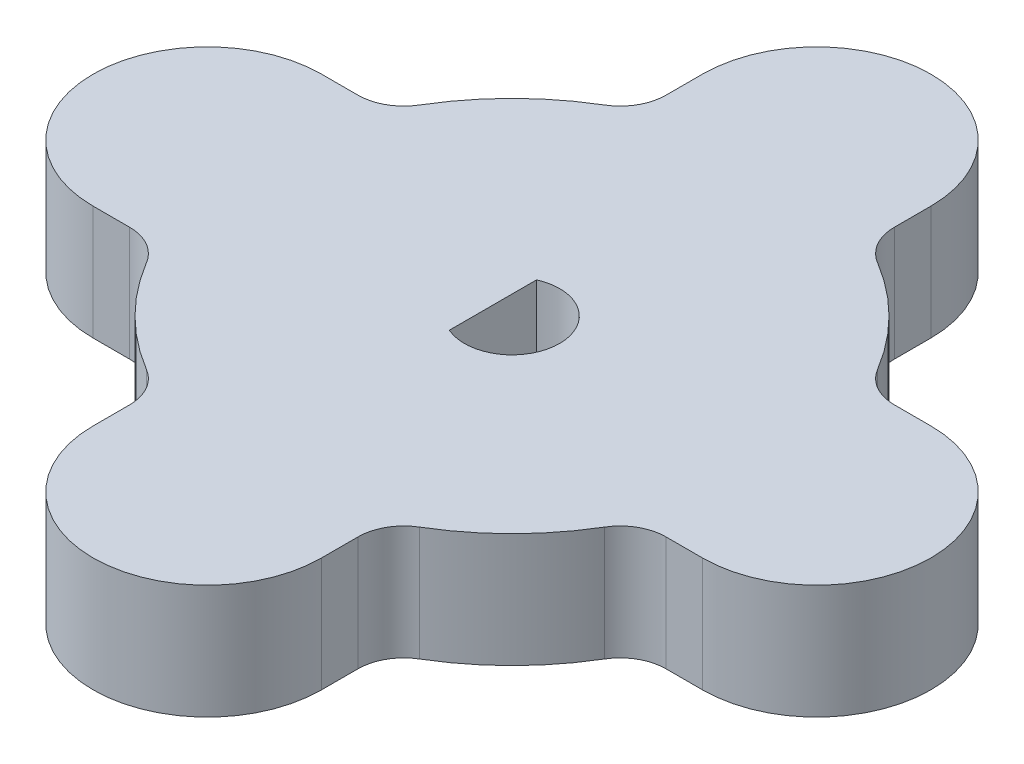
from build123d import *

# Parameters (mm, degrees)
SKETCH1_W           = 19.05
SKETCH1_H           = 19.05
BOSS_EXTRUDE1_DEPTH = 9.525
FILLET1_R           = 3.81
CUT_EXTRUDE1_DEPTH  = 61.38309394


with BuildPart() as part:
    # Sketch1 → Boss-Extrude1 (new body)
    with BuildSketch(Plane(origin=(0, 0, 0), x_dir=(1, 0, 0), z_dir=(0, 1, 0))):
        with BuildLine():
            Line((-3.432814358, 26.008484179), (-22.482814358, 26.008484179))
            Line((-22.482814358, 26.008484179), (-22.482814358, 20.688947321))
            ThreePointArc((-22.482814358, 20.688947321), (-12.957814358, 22.833484179), (-3.432814358, 20.688947321))
            Line((-3.432814358, 20.688947321), (-3.432814358, 26.008484179))
        make_face()
        with BuildLine():
            ThreePointArc((-3.432814358, 20.688947321), (-12.957814358, 22.833484179), (-22.482814358, 20.688947321))
            Line((-22.482814358, 20.688947321), (-22.482814358, 10.133484179))
            Line((-22.482814358, 10.133484179), (-3.432814358, 10.133484179))
            Line((-3.432814358, 10.133484179), (-3.432814358, 20.688947321))
        make_face()
        with BuildLine():
            ThreePointArc((-22.482814358, 26.008484179), (-12.957814358, 35.533484179), (-3.432814358, 26.008484179))
            Line((-3.432814358, 26.008484179), (-22.482814358, 26.008484179))
        make_face()
        with Locations((-12.957814358, 0.608484179)):
            Rectangle(SKETCH1_W, SKETCH1_H)
        with BuildLine():
            Line((-22.482814358, -8.916515821), (-22.482814358, 10.133484179))
            Line((-22.482814358, 10.133484179), (-33.0382775, 10.133484179))
            ThreePointArc((-33.0382775, 10.133484179), (-35.182814358, 0.608484179), (-33.0382775, -8.916515821))
            Line((-33.0382775, -8.916515821), (-22.482814358, -8.916515821))
        make_face()
        with BuildLine():
            ThreePointArc((-33.0382775, -8.916515821), (-35.182814358, 0.608484179), (-33.0382775, 10.133484179))
            Line((-33.0382775, 10.133484179), (-38.357814358, 10.133484179))
            Line((-38.357814358, 10.133484179), (-38.357814358, -8.916515821))
            Line((-38.357814358, -8.916515821), (-33.0382775, -8.916515821))
        make_face()
        with BuildLine():
            Line((-38.357814358, 10.133484179), (-38.357814358, -8.916515821))
            ThreePointArc((-38.357814358, -8.916515821), (-47.882814358, 0.608484179), (-38.357814358, 10.133484179))
        make_face()
        with BuildLine():
            Line((-22.482814358, -19.471978963), (-22.482814358, -8.916515821))
            Line((-22.482814358, -8.916515821), (-33.0382775, -8.916515821))
            ThreePointArc((-33.0382775, -8.916515821), (-28.67326257, -15.106964033), (-22.482814358, -19.471978963))
        make_face()
        with BuildLine():
            Line((-3.432814358, -8.916515821), (-22.482814358, -8.916515821))
            Line((-22.482814358, -8.916515821), (-22.482814358, -19.471978963))
            ThreePointArc((-22.482814358, -19.471978963), (-12.957814358, -21.616515821), (-3.432814358, -19.471978963))
            Line((-3.432814358, -19.471978963), (-3.432814358, -8.916515821))
        make_face()
        with BuildLine():
            ThreePointArc((-3.432814358, -19.471978963), (-12.957814358, -21.616515821), (-22.482814358, -19.471978963))
            Line((-22.482814358, -19.471978963), (-22.482814358, -24.791515821))
            Line((-22.482814358, -24.791515821), (-3.432814358, -24.791515821))
            Line((-3.432814358, -24.791515821), (-3.432814358, -19.471978963))
        make_face()
        with BuildLine():
            ThreePointArc((-3.432814358, -24.791515821), (-12.957814358, -34.316515821), (-22.482814358, -24.791515821))
            Line((-22.482814358, -24.791515821), (-3.432814358, -24.791515821))
        make_face()
        with BuildLine():
            ThreePointArc((7.122648784, 10.133484179), (2.757633854, 16.323932391), (-3.432814358, 20.688947321))
            Line((-3.432814358, 20.688947321), (-3.432814358, 10.133484179))
            Line((-3.432814358, 10.133484179), (7.122648784, 10.133484179))
        make_face()
        with BuildLine():
            Line((7.122648784, 10.133484179), (-3.432814358, 10.133484179))
            Line((-3.432814358, 10.133484179), (-3.432814358, -8.916515821))
            Line((-3.432814358, -8.916515821), (7.122648784, -8.916515821))
            ThreePointArc((7.122648784, -8.916515821), (8.724423976, -4.273233329), (9.267185642, 0.608484179))
            ThreePointArc((9.267185642, 0.608484179), (8.724423976, 5.490201688), (7.122648784, 10.133484179))
        make_face()
        with BuildLine():
            Line((7.122648784, -8.916515821), (-3.432814358, -8.916515821))
            Line((-3.432814358, -8.916515821), (-3.432814358, -19.471978963))
            ThreePointArc((-3.432814358, -19.471978963), (2.757633854, -15.106964033), (7.122648784, -8.916515821))
        make_face()
        with BuildLine():
            Line((12.442185642, 10.133484179), (7.122648784, 10.133484179))
            ThreePointArc((7.122648784, 10.133484179), (8.724423976, 5.490201688), (9.267185642, 0.608484179))
            ThreePointArc((9.267185642, 0.608484179), (8.724423976, -4.273233329), (7.122648784, -8.916515821))
            Line((7.122648784, -8.916515821), (12.442185642, -8.916515821))
            Line((12.442185642, -8.916515821), (12.442185642, 10.133484179))
        make_face()
        with BuildLine():
            ThreePointArc((12.442185642, 10.133484179), (21.967185642, 0.608484179), (12.442185642, -8.916515821))
            Line((12.442185642, -8.916515821), (12.442185642, 10.133484179))
        make_face()
        with BuildLine():
            Line((-22.482814358, 10.133484179), (-22.482814358, 20.688947321))
            ThreePointArc((-22.482814358, 20.688947321), (-28.67326257, 16.323932391), (-33.0382775, 10.133484179))
            Line((-33.0382775, 10.133484179), (-22.482814358, 10.133484179))
        make_face()
    extrude(amount=BOSS_EXTRUDE1_DEPTH)

    # Fillet1
    fillet1_edges = [part.edges().sort_by_distance(p)[0] for p in [
        (-22.482814358, 4.7625, -20.688947321),
        (-3.432814358, 4.7625, -20.688947321),
        (7.122648784, 4.7625, -10.133484179),
        (7.122648784, 4.7625, 8.916515821),
        (-3.432814358, 4.7625, 19.471978963),
        (-22.482814358, 4.7625, 19.471978963),
        (-33.0382775, 4.7625, 8.916515821),
        (-33.0382775, 4.7625, -10.133484179),
    ]]
    fillet(fillet1_edges, radius=FILLET1_R)

    # Sketch2 → Cut-Extrude1 (cut, through all)
    with BuildSketch(Plane(origin=(0, 9.525, 0), x_dir=(1, 0, 0), z_dir=(0, 1, 0))):
        with BuildLine():
            ThreePointArc((-8.989064358, 0.608484179), (-10.784040458, 3.92897866), (-14.545314358, 4.245903637))
            Line((-14.545314358, 4.245903637), (-14.545314358, 0.608484179))
            Line((-14.545314358, 0.608484179), (-8.989064358, 0.608484179))
        make_face()
        with BuildLine():
            Line((-8.989064358, 0.608484179), (-14.545314358, 0.608484179))
            Line((-14.545314358, 0.608484179), (-14.545314358, -3.028935279))
            ThreePointArc((-14.545314358, -3.028935279), (-10.784040458, -2.712010301), (-8.989064358, 0.608484179))
        make_face()
    extrude(amount=-CUT_EXTRUDE1_DEPTH, mode=Mode.SUBTRACT)


solid = part.part
